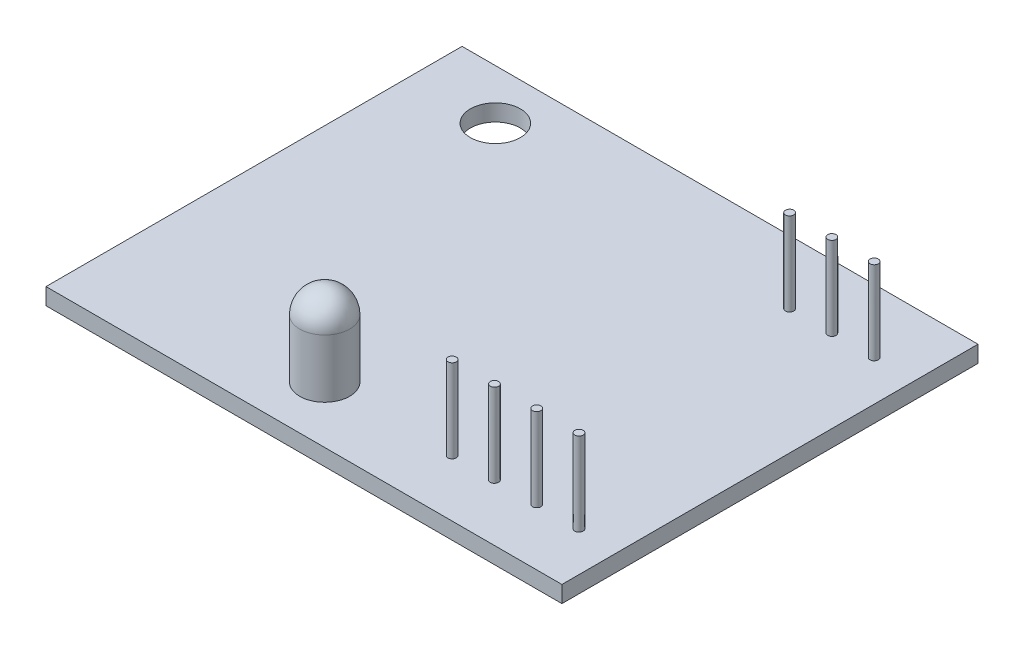
from build123d import *

# Parameters (mm, degrees)
SKICA1_W                  = 31
SKICA1_H                  = 25
P_IDAT_VYSUNUT_M1_DEPTH   = 1
P_IDAT_VYSUNUT_M2_DEPTH   = 6
SKICA3_W                  = 5
SKICA3_H                  = 5
ODEBRAT_VYSUNUT_M1_DEPTH  = 0.5
SKICA4_R                  = 1.5
ODEBRAT_VYSUNUT_M2_DEPTH  = 41.274061131
ZKOSEN_1_SIZE             = 0.3
SKICA5_R                  = 0.25
P_IDAT_VYSUNUT_M3_DEPTH   = 5
P_IDAT_VYSUNUT_M3_2_DEPTH = 5
P_IDAT_VYSUNUT_M3_3_DEPTH = 5
P_IDAT_VYSUNUT_M3_4_DEPTH = 5
P_IDAT_VYSUNUT_M3_5_DEPTH = 5
P_IDAT_VYSUNUT_M3_6_DEPTH = 5
P_IDAT_VYSUNUT_M3_7_DEPTH = 5
SKICA7_R                  = 0.25
P_IDAT_VYSUNUT_M5_DEPTH   = 0.5
SKICA6_R                  = 1.5
P_IDAT_VYSUNUT_M4_DEPTH   = 5
ZAOBLIT1_R                = 1.5


with BuildPart() as part:
    # Skica1 → Přidat vysunutím1 (new body)
    with BuildSketch(Plane(origin=(0, 0, 0), x_dir=(1, 0, 0), z_dir=(0, 1, 0))):
        with Locations((15.5, 12.5)):
            Rectangle(SKICA1_W, SKICA1_H)
    extrude(amount=P_IDAT_VYSUNUT_M1_DEPTH)

    # Skica4 → Odebrat vysunutím2 (cut, through all)
    with BuildSketch(Plane.XZ):
        with Locations(Location((5, -22, 0), (0, 0, 270))):
            Circle(SKICA4_R)
    extrude(amount=-ODEBRAT_VYSUNUT_M2_DEPTH, mode=Mode.SUBTRACT)



with BuildPart() as body_2:
    # Skica2 → Přidat vysunutím2 (new body)
    with BuildSketch(Plane.XZ):
        Polygon((1.5, -6.5), (1.5, -9.75), (2, -9.75), (2, -10.25), (1.5, -10.25), (1.5, -13.5), (8.5, -13.5), (8.5, -10.25), (8, -10.25), (8, -9.75), (8.5, -9.75), (8.5, -6.5), align=None)
    extrude(amount=P_IDAT_VYSUNUT_M2_DEPTH)

    # Skica3 → Odebrat vysunutím1 (cut)
    with BuildSketch(Plane.XZ.offset(6)):
        with Locations((5, -10)):
            Rectangle(SKICA3_W, SKICA3_H)
    extrude(amount=-ODEBRAT_VYSUNUT_M1_DEPTH, mode=Mode.SUBTRACT)

    # Zkosení1
    zkosen_1_edges = [body_2.edges().sort_by_distance(p)[0] for p in [
        (1.5, -6, -11.875),
        (5, -6, -13.5),
        (8.5, -6, -11.875),
        (8.5, -6, -8.125),
        (5, -6, -6.5),
        (1.5, -6, -8.125),
    ]]
    chamfer(zkosen_1_edges, length=ZKOSEN_1_SIZE)


with BuildPart() as body_3:
    # Skica5 → Přidat vysunutím3 (new body)
    with BuildSketch(Plane(origin=(0, 1, 0), x_dir=(1, 0, 0), z_dir=(0, 1, 0))):
        with Locations(Location((20.995, 3.41, 0), (0, 0, 270))):
            Circle(SKICA5_R)
    extrude(amount=P_IDAT_VYSUNUT_M3_DEPTH)


with BuildPart() as body_4:
    # Skica5 → P_idat vysunut_m3 2 (new body)
    with BuildSketch(Plane(origin=(0, 1, 0), x_dir=(1, 0, 0), z_dir=(0, 1, 0))):
        with Locations(Location((23.535, 3.41, 0), (0, 0, 270))):
            Circle(SKICA5_R)
    extrude(amount=P_IDAT_VYSUNUT_M3_2_DEPTH)


with BuildPart() as body_5:
    # Skica5 → P_idat vysunut_m3 3 (new body)
    with BuildSketch(Plane(origin=(0, 1, 0), x_dir=(1, 0, 0), z_dir=(0, 1, 0))):
        with Locations(Location((26.075, 3.41, 0), (0, 0, 270))):
            Circle(SKICA5_R)
    extrude(amount=P_IDAT_VYSUNUT_M3_3_DEPTH)


with BuildPart() as body_6:
    # Skica5 → P_idat vysunut_m3 4 (new body)
    with BuildSketch(Plane(origin=(0, 1, 0), x_dir=(1, 0, 0), z_dir=(0, 1, 0))):
        with Locations(Location((28.615, 3.41, 0), (0, 0, 270))):
            Circle(SKICA5_R)
    extrude(amount=P_IDAT_VYSUNUT_M3_4_DEPTH)


with BuildPart() as body_7:
    # Skica5 → P_idat vysunut_m3 5 (new body)
    with BuildSketch(Plane(origin=(0, 1, 0), x_dir=(1, 0, 0), z_dir=(0, 1, 0))):
        with Locations(Location((28.57, 21.19, 0), (0, 0, 270))):
            Circle(SKICA5_R)
    extrude(amount=P_IDAT_VYSUNUT_M3_5_DEPTH)


with BuildPart() as body_8:
    # Skica5 → P_idat vysunut_m3 6 (new body)
    with BuildSketch(Plane(origin=(0, 1, 0), x_dir=(1, 0, 0), z_dir=(0, 1, 0))):
        with Locations(Location((26.03, 21.19, 0), (0, 0, 270))):
            Circle(SKICA5_R)
    extrude(amount=P_IDAT_VYSUNUT_M3_6_DEPTH)


with BuildPart() as body_9:
    # Skica5 → P_idat vysunut_m3 7 (new body)
    with BuildSketch(Plane(origin=(0, 1, 0), x_dir=(1, 0, 0), z_dir=(0, 1, 0))):
        with Locations(Location((23.49, 21.19, 0), (0, 0, 270))):
            Circle(SKICA5_R)
    extrude(amount=P_IDAT_VYSUNUT_M3_7_DEPTH)


with BuildPart() as part_1:
    add(part.part)

    add(body_3.part)  # Přidat vysunutím5 merges body 3

    add(body_4.part)  # Přidat vysunutím5 merges body 4

    add(body_5.part)  # Přidat vysunutím5 merges body 5

    add(body_6.part)  # Přidat vysunutím5 merges body 6

    add(body_7.part)  # Přidat vysunutím5 merges body 7

    add(body_8.part)  # Přidat vysunutím5 merges body 8

    add(body_9.part)  # Přidat vysunutím5 merges body 9
    # Skica7 → Přidat vysunutím5 (add)
    with BuildSketch(Plane(origin=(0, 1, 0), x_dir=(1, 0, 0), z_dir=(0, 1, 0))):
        with Locations(Location((23.49, 21.19, 0), (0, 0, 90))):
            Circle(SKICA7_R)
        with Locations(Location((26.03, 21.19, 0), (0, 0, 90))):
            Circle(SKICA7_R)
        with Locations(Location((28.57, 21.19, 0), (0, 0, 90))):
            Circle(SKICA7_R)
        with Locations(Location((20.995, 3.41, 0), (0, 0, 90))):
            Circle(SKICA7_R)
        with Locations(Location((23.535, 3.41, 0), (0, 0, 90))):
            Circle(SKICA7_R)
        with Locations(Location((26.075, 3.41, 0), (0, 0, 90))):
            Circle(SKICA7_R)
        with Locations(Location((28.615, 3.41, 0), (0, 0, 90))):
            Circle(SKICA7_R)
    extrude(amount=P_IDAT_VYSUNUT_M5_DEPTH)

    # Skica6 → Přidat vysunutím4 (add)
    with BuildSketch(Plane(origin=(0, 1, 0), x_dir=(1, 0, 0), z_dir=(0, 1, 0))):
        with Locations(Location((13.335, 3.41, 0), (0, 0, 90))):
            Circle(SKICA6_R)
    extrude(amount=P_IDAT_VYSUNUT_M4_DEPTH)

    # Zaoblit1
    zaoblit1_edges = [part_1.edges().sort_by_distance(p)[0] for p in [
        (13.335, 6, -1.91),
    ]]
    fillet(zaoblit1_edges, radius=ZAOBLIT1_R)


solid = Compound([body_2.part, part_1.part])
